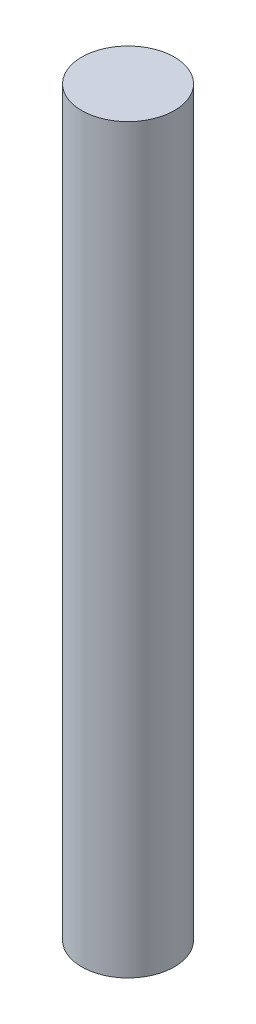
from build123d import *

# Parameters (mm, degrees)
SKETCH1_R           = 2.38125
BOSS_EXTRUDE1_DEPTH = 19.05


with BuildPart() as part:
    # Sketch1 → Boss-Extrude1 (new, symmetric)
    with BuildSketch(Plane(origin=(0, 0, 0), x_dir=(1, 0, 0), z_dir=(0, 1, 0))):
        with Locations(Location((0, 0, 0), (0, 0, 90))):
            Circle(SKETCH1_R)
    extrude(amount=BOSS_EXTRUDE1_DEPTH, both=True)


solid = part.part
